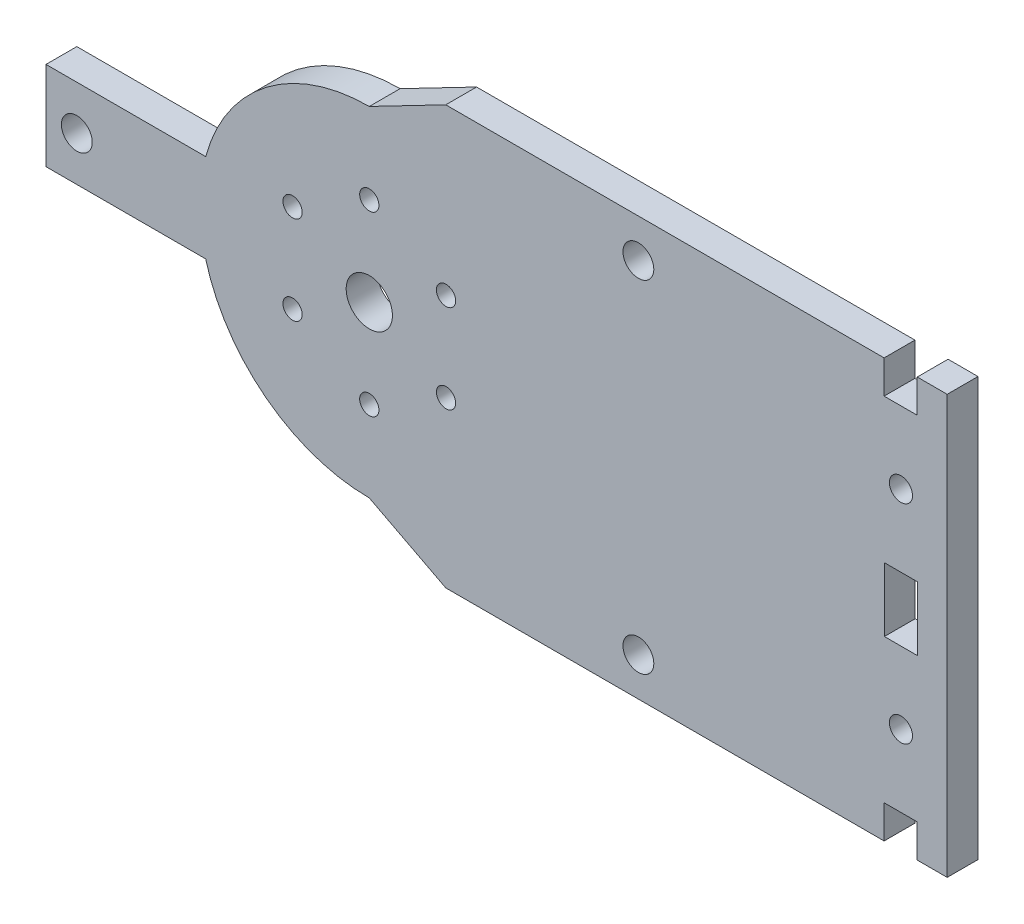
from build123d import *

# Parameters (mm, degrees)
SKETCH_1_R      = 1.5
SKETCH_1_R_2    = 3
SKETCH_1_R_3    = 1.25
SKETCH_1_R_4    = 2
SKETCH_1_W      = 4.3
SKETCH_1_H      = 8.3
EXTRUDE_1_DEPTH = 4


with BuildPart() as part:
    # 草图1 → 凸台-拉伸1 (new body)
    with BuildSketch(Plane.XY):
        with BuildLine():
            Line((32.115707856, 27.15), (32.115707856, 22.85))
            Line((32.115707856, 22.85), (27.815707856, 22.85))
            Line((27.815707856, 22.85), (27.815707856, 27.15))
            Line((27.815707856, 27.15), (-29.075, 27.15))
            Line((-29.075, 27.15), (-38.998995168, 22.002009663))
            ThreePointArc((-38.998995168, 22.002009663), (-52.370174504, 17.472835843), (-60.236366221, 5.75))
            Line((-60.236366221, 5.75), (-80.958287312, 5.75))
            Line((-80.958287312, 5.75), (-80.958287312, -5.75))
            Line((-80.958287312, -5.75), (-60.236366221, -5.75))
            ThreePointArc((-60.236366221, -5.75), (-52.370174504, -17.472835843), (-38.998995168, -22.002009663))
            Line((-38.998995168, -22.002009663), (-29.075, -27.15))
            Line((-29.075, -27.15), (27.815707856, -27.15))
            Line((27.815707856, -27.15), (27.815707856, -22.85))
            Line((27.815707856, -22.85), (32.115707856, -22.85))
            Line((32.115707856, -22.85), (32.115707856, -27.15))
            Line((32.115707856, -27.15), (36.001004832, -27.15))
            Line((36.001004832, -27.15), (36.001004832, 27.15))
            Line((36.001004832, 27.15), (32.115707856, 27.15))
        make_face()
        with Locations((30.001004832, 13.5)):
            Circle(SKETCH_1_R, mode=Mode.SUBTRACT)
        with Locations(Location((30.001004832, -13.5, 0), (0, 0, 180))):
            Circle(SKETCH_1_R, mode=Mode.SUBTRACT)
        with Locations((-38.998995168, 0)):
            Circle(SKETCH_1_R_2, mode=Mode.SUBTRACT)
        with Locations((-38.998995168, -11.5)):
            Circle(SKETCH_1_R_3, mode=Mode.SUBTRACT)
        with Locations((-48.958287312, -5.75)):
            Circle(SKETCH_1_R_3, mode=Mode.SUBTRACT)
        with Locations((-48.958287312, 5.75)):
            Circle(SKETCH_1_R_3, mode=Mode.SUBTRACT)
        with Locations((-38.998995168, 11.5)):
            Circle(SKETCH_1_R_3, mode=Mode.SUBTRACT)
        with Locations((-29.039703025, 5.75)):
            Circle(SKETCH_1_R_3, mode=Mode.SUBTRACT)
        with Locations((-29.039703025, -5.75)):
            Circle(SKETCH_1_R_3, mode=Mode.SUBTRACT)
        with Locations((-4.075, -22.15)):
            Circle(SKETCH_1_R_4, mode=Mode.SUBTRACT)
        with Locations((-4.075, 22.15)):
            Circle(SKETCH_1_R_4, mode=Mode.SUBTRACT)
        with Locations((-76.958287312, 0)):
            Circle(SKETCH_1_R_4, mode=Mode.SUBTRACT)
        with Locations((30.001004832, 0)):
            Rectangle(SKETCH_1_W, SKETCH_1_H, mode=Mode.SUBTRACT)
    extrude(amount=EXTRUDE_1_DEPTH)


solid = part.part
